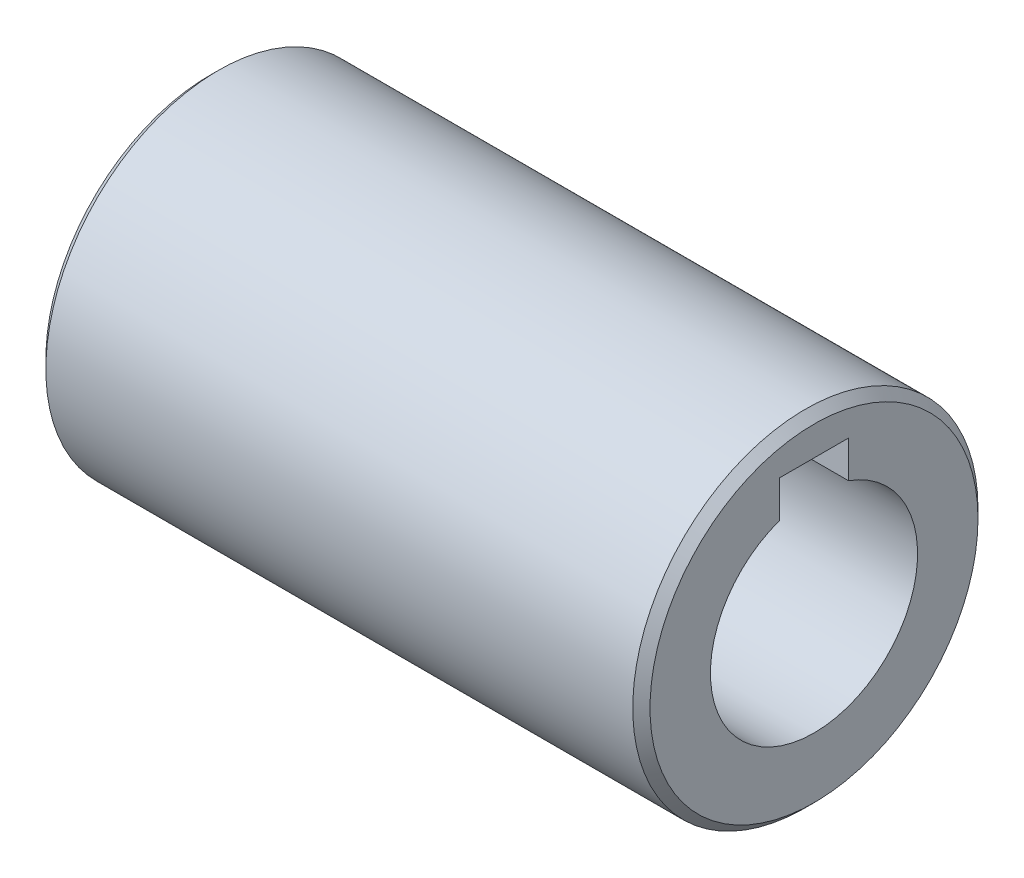
from build123d import *

# Parameters (mm, degrees)
ESQUISSE1_R             = 10
ESQUISSE1_R_2           = 6
BOSS_EXTRU_1_DEPTH      = 35
ESQUISSE2_W             = 4
ESQUISSE2_H             = 6.064626471
ENL_V_MAT_EXTRU_1_DEPTH = 38.749172176
CHANFREIN1_SIZE         = 0.5


with BuildPart() as part:
    # Esquisse1 → Boss.-Extru.1 (new body)
    with BuildSketch(Plane(origin=(0, 0, 0), x_dir=(0, 0, -1), z_dir=(1, 0, 0))):
        Circle(ESQUISSE1_R)
        Circle(ESQUISSE1_R_2, mode=Mode.SUBTRACT)
    extrude(amount=BOSS_EXTRU_1_DEPTH)

    # Esquisse2 → Enlèv. mat.-Extru.1 (cut, through all)
    with BuildSketch(Plane.ZY):
        with Locations((0, 4.767686765)):
            Rectangle(ESQUISSE2_W, ESQUISSE2_H)
    extrude(amount=-ENL_V_MAT_EXTRU_1_DEPTH, mode=Mode.SUBTRACT)

    # Chanfrein1
    chanfrein1_edges = [part.edges().sort_by_distance(p)[0] for p in [
        (0, 0, 10),
        (35, 0, 10),
    ]]
    chamfer(chanfrein1_edges, length=CHANFREIN1_SIZE)


solid = part.part
